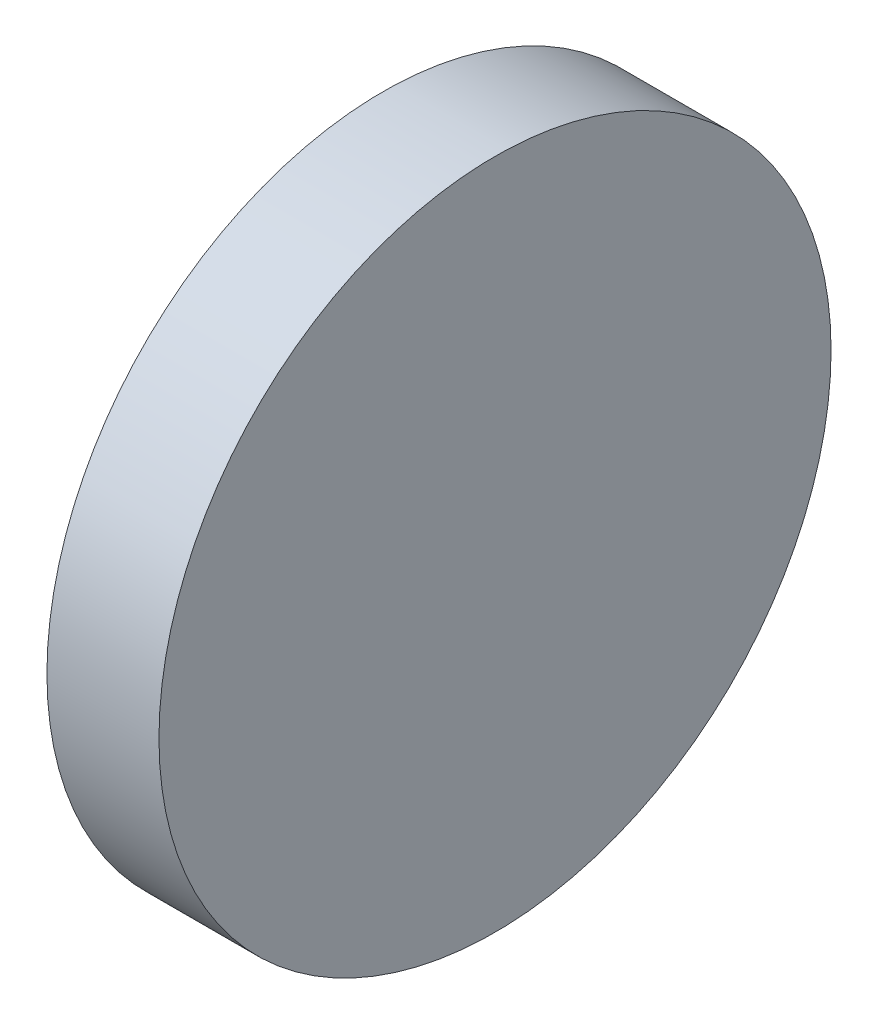
from build123d import *

# Parameters (mm, degrees)
SKETCH1_W = 1
SKETCH1_H = 3


with BuildPart() as part:
    # Sketch1 → Revolve1 (revolve)
    with BuildSketch(Plane.XY, mode=Mode.PRIVATE) as revolve1_sk:
        with Locations((0.5, 1.5)):
            Rectangle(SKETCH1_W, SKETCH1_H)
    revolve(revolve1_sk.sketch.rotate(Axis((-163.101639334, 0, 0), (1, 0, 0)), 90), axis=Axis((-163.101639334, 0, 0), (1, 0, 0)))


solid = part.part
